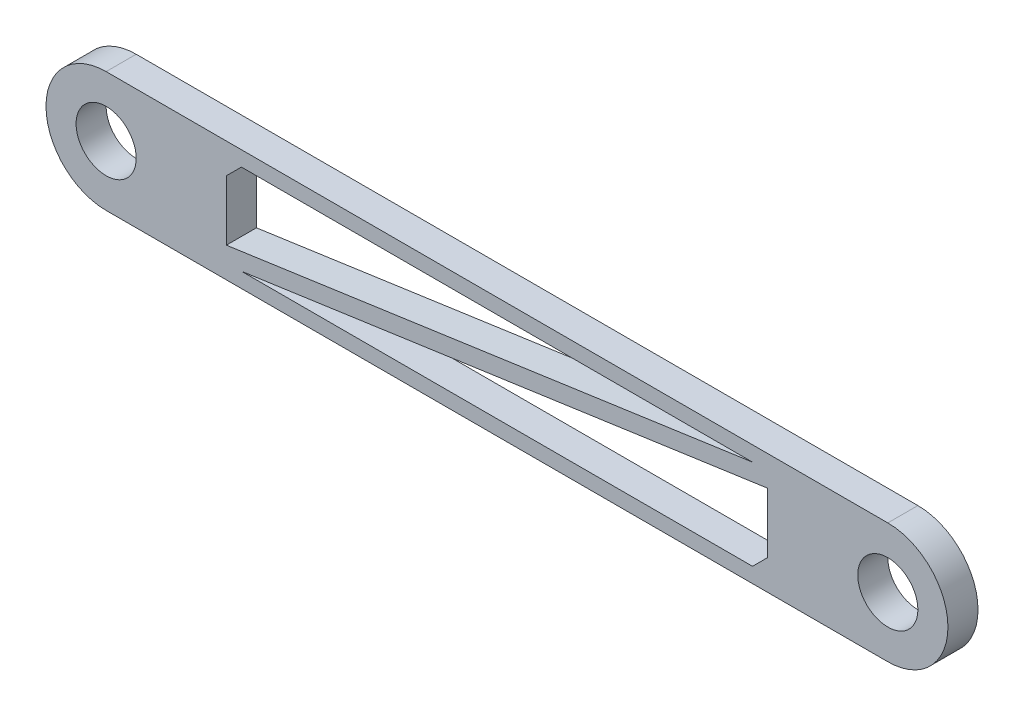
from build123d import *

# Parameters (mm, degrees)
SKETCH1_R           = 10
BOSS_EXTRUDE1_DEPTH = 10


with BuildPart() as part:
    # Sketch1 → Boss-Extrude1 (new body)
    with BuildSketch(Plane.XY):
        with BuildLine():
            Line((-130, -20), (130, -20))
            ThreePointArc((130, -20), (150, 0), (130, 20))
            Line((130, 20), (-130, 20))
            ThreePointArc((-130, 20), (-150, 0), (-130, -20))
        make_face()
        with Locations((130, 0)):
            Circle(SKETCH1_R, mode=Mode.SUBTRACT)
        with Locations((-130, 0)):
            Circle(SKETCH1_R, mode=Mode.SUBTRACT)
        Polygon((-90, 10), (-85, 15), (85, 15), (-90, -10), align=None, mode=Mode.SUBTRACT)
        Polygon((-85, -15), (85, -15), (90, -10), (90, 10), align=None, mode=Mode.SUBTRACT)
    extrude(amount=BOSS_EXTRUDE1_DEPTH)


solid = part.part
